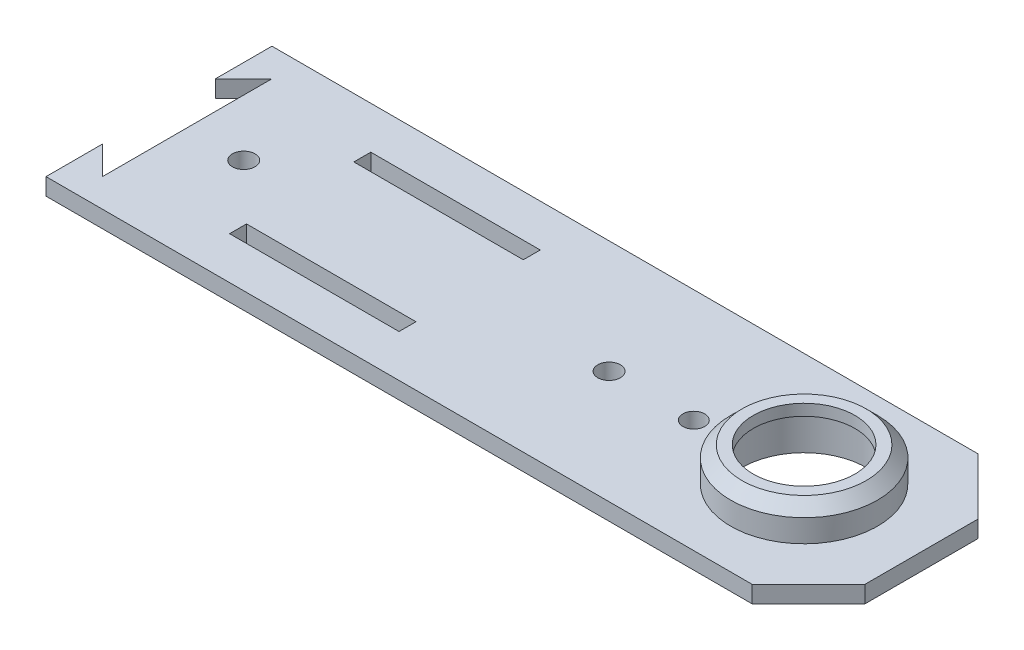
from build123d import *

# Parameters (mm, degrees)
CROQUIS1_R              = 11
CROQUIS1_R_2            = 2
CROQUIS1_R_3            = 1.937672591
CROQUIS1_W              = 30
CROQUIS1_H              = 3
SALIENTE_EXTRUIR1_DEPTH = 3
CROQUIS2_R              = 13
CROQUIS2_R_2            = 11
SALIENTE_EXTRUIR2_DEPTH = 4
CROQUIS3_R              = 13
CROQUIS3_R_2            = 9
SALIENTE_EXTRUIR3_DEPTH = 2
CHAFL_N1_SIZE           = 2
CHAFL_N2_SIZE           = 10


with BuildPart() as part:
    # Croquis1 → Saliente-Extruir1 (new body)
    with BuildSketch(Plane(origin=(0, 0, 0), x_dir=(1, 0, 0), z_dir=(0, 1, 0))):
        Polygon((-67.5, 10), (-62.5, 15), (-62.5, -15), (-67.5, -10), (-67.5, -20), (67.5, -20), (67.5, 20), (-67.5, 20), align=None)
        with Locations(Location((46.713951104, 0, 0), (0, 0, 270))):
            Circle(CROQUIS1_R, mode=Mode.SUBTRACT)
        with Locations(Location((-52.5, 0, 0), (0, 0, 270))):
            Circle(CROQUIS1_R_2, mode=Mode.SUBTRACT)
        with Locations(Location((27.185770037, 0, 0), (0, 0, 270))):
            Circle(CROQUIS1_R_3, mode=Mode.SUBTRACT)
        with Locations(Location((12.185770037, 0, 0), (0, 0, 270))):
            Circle(CROQUIS1_R_2, mode=Mode.SUBTRACT)
        with Locations((-27.5, 11)):
            Rectangle(CROQUIS1_W, CROQUIS1_H, mode=Mode.SUBTRACT)
        with Locations((-27.5, -11)):
            Rectangle(CROQUIS1_W, CROQUIS1_H, mode=Mode.SUBTRACT)
    extrude(amount=SALIENTE_EXTRUIR1_DEPTH)

    # Croquis2 → Saliente-Extruir2 (add)
    with BuildSketch(Plane(origin=(0, 3, 0), x_dir=(1, 0, 0), z_dir=(0, 1, 0))):
        with Locations(Location((46.713951104, 0, 0), (0, 0, 90))):
            Circle(CROQUIS2_R)
        with Locations(Location((46.713951104, 0, 0), (0, 0, 270))):
            Circle(CROQUIS2_R_2, mode=Mode.SUBTRACT)
    extrude(amount=SALIENTE_EXTRUIR2_DEPTH)

    # Croquis3 → Saliente-Extruir3 (add)
    with BuildSketch(Plane(origin=(0, 7, 0), x_dir=(1, 0, 0), z_dir=(0, 1, 0))):
        with Locations(Location((46.713951104, 0, 0), (0, 0, 90))):
            Circle(CROQUIS3_R)
        with Locations(Location((46.713951104, 0, 0), (0, 0, 270))):
            Circle(CROQUIS3_R_2, mode=Mode.SUBTRACT)
    extrude(amount=SALIENTE_EXTRUIR3_DEPTH)

    # Chaflán1
    chafl_n1_edges = [part.edges().sort_by_distance(p)[0] for p in [
        (46.713951104, 9, 13),
    ]]
    chamfer(chafl_n1_edges, length=CHAFL_N1_SIZE)

    # Chaflán2
    chafl_n2_edges = [part.edges().sort_by_distance(p)[0] for p in [
        (67.5, 1.5, 20),
        (67.5, 1.5, -20),
    ]]
    chamfer(chafl_n2_edges, length=CHAFL_N2_SIZE)


solid = part.part
